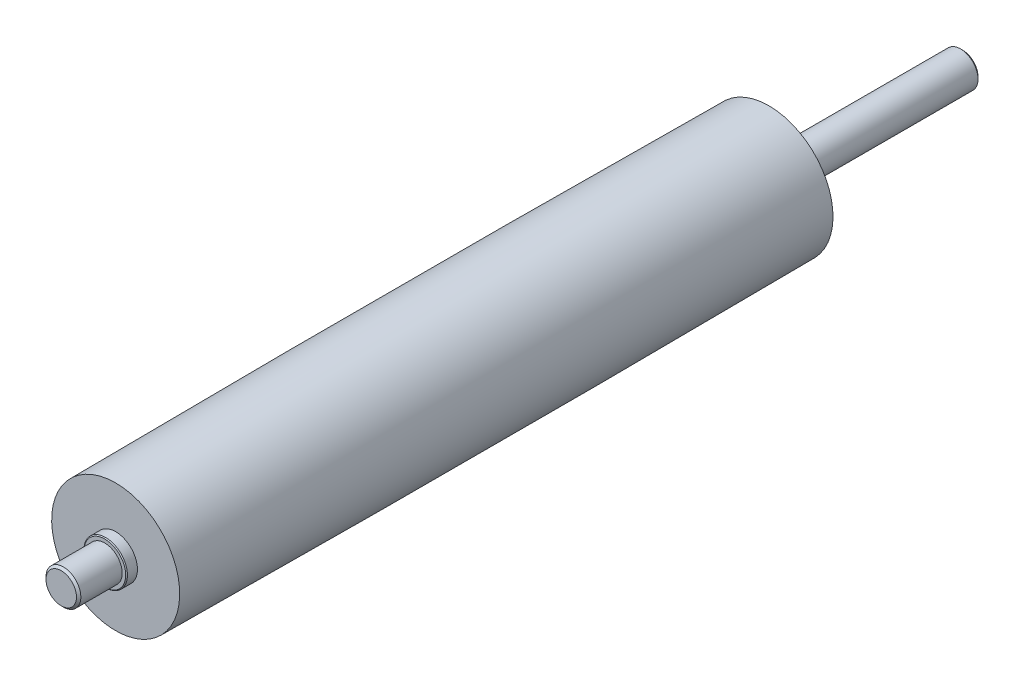
from build123d import *

# Parameters (mm, degrees)
CHAMFER1_SIZE = 0.5
CHAMFER2_SIZE = 0.2


with BuildPart() as part:
    # Sketch1 → Revolve1 (revolve)
    with BuildSketch(Plane(origin=(0, 0, 0), x_dir=(0, 0, -1), z_dir=(1, 0, 0))):
        with BuildLine():
            Line((77.5, 6), (77.5, 4))
            Line((77.5, 4), (119.5, 4))
            Line((119.5, 4), (119.5, 0))
            Line((119.5, 0), (-87.5, 0))
            Line((-87.5, 0), (-87.5, 4))
            Line((-87.5, 4), (-77.5, 4))
            Line((-77.5, 4), (-77.5, 5))
            Line((-77.5, 5), (-75, 5))
            Line((-75, 5), (-75, 14.7))
            ThreePointArc((-75, 14.7), (0, 15), (75, 14.7))
            Line((75, 14.7), (75, 6))
            Line((75, 6), (77.5, 6))
        make_face()
    revolve(axis=Axis((0, 0, -119.5), (0, 0, 1)))

    # Chamfer1
    chamfer1_edges = [part.edges().sort_by_distance(p)[0] for p in [
        (0, -4, -119.5),
        (0, -4, 87.5),
    ]]
    chamfer(chamfer1_edges, length=CHAMFER1_SIZE)

    # Chamfer2
    chamfer2_edges = [part.edges().sort_by_distance(p)[0] for p in [
        (0, -5, 77.5),
    ]]
    chamfer(chamfer2_edges, length=CHAMFER2_SIZE)


solid = part.part
